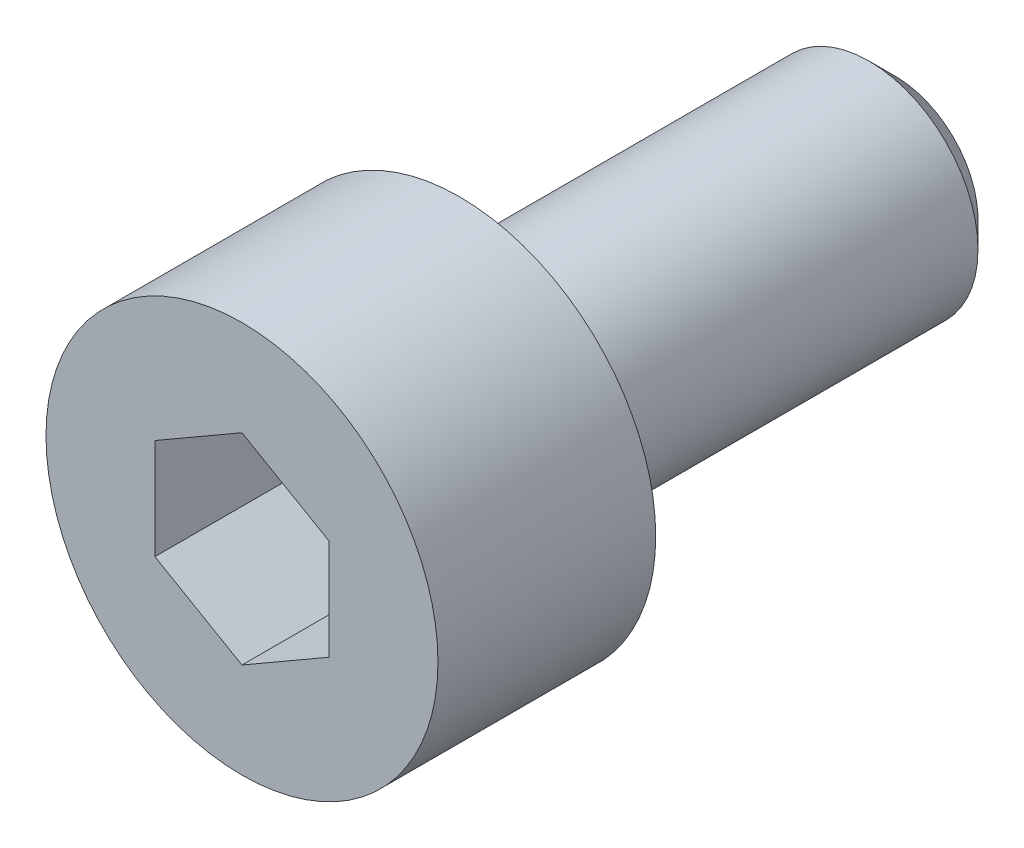
from build123d import *

# Parameters (mm, degrees)
SKETCH1_R           = 2.25
BOSS_EXTRUDE1_DEPTH = 2.5
SKETCH2_R           = 1.25
BOSS_EXTRUDE2_DEPTH = 5
CHAMFER1_SIZE       = 0.3
CUT_EXTRUDE1_DEPTH  = 2


with BuildPart() as part:
    # Sketch1 → Boss-Extrude1 (new body)
    with BuildSketch(Plane.XY):
        Circle(SKETCH1_R)
    extrude(amount=BOSS_EXTRUDE1_DEPTH)

    # Sketch2 → Boss-Extrude2 (add)
    with BuildSketch(Plane(origin=(0, 0, 0), x_dir=(-1, 0, 0), z_dir=(0, 0, -1))):
        with Locations(Location((0, 0, 0), (0, 0, 180))):
            Circle(SKETCH2_R)
    extrude(amount=BOSS_EXTRUDE2_DEPTH)

    # Chamfer1
    chamfer1_edges = [part.edges().sort_by_distance(p)[0] for p in [
        (-1.25, 0, -5),
    ]]
    chamfer(chamfer1_edges, length=CHAMFER1_SIZE)

    # Sketch3 → Cut-Extrude1 (cut)
    with BuildSketch(Plane.XY.offset(2.5)):
        Polygon((0, 1.154700538), (-1, 0.577350269), (-1, -0.577350269), (0, -1.154700538), (1, -0.577350269), (1, 0.577350269), align=None)
    extrude(amount=-CUT_EXTRUDE1_DEPTH, mode=Mode.SUBTRACT)


solid = part.part
